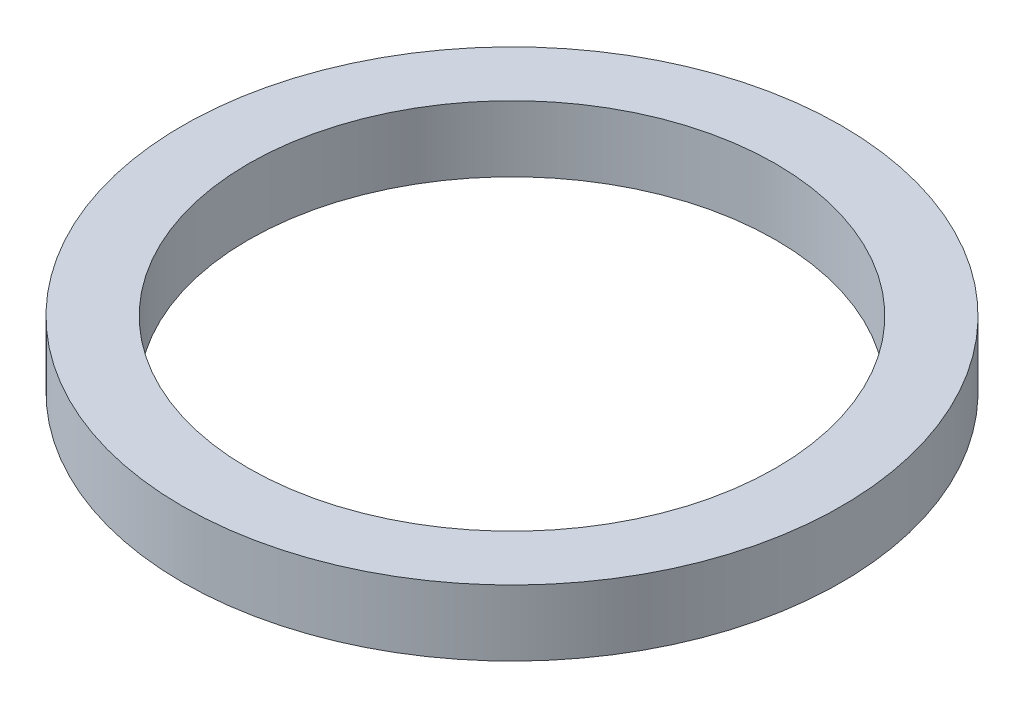
from build123d import *

# Parameters (mm, degrees)
CROQUIS1_R              = 5
CROQUIS1_R_2            = 4
SALIENTE_EXTRUIR1_DEPTH = 1


with BuildPart() as part:
    # Croquis1 → Saliente-Extruir1 (new body)
    with BuildSketch(Plane(origin=(0, 0, 0), x_dir=(1, 0, 0), z_dir=(0, 1, 0))):
        with Locations(Location((0, 0, 0), (0, 0, 270))):
            Circle(CROQUIS1_R)
        with Locations(Location((0, 0, 0), (0, 0, 270))):
            Circle(CROQUIS1_R_2, mode=Mode.SUBTRACT)
    extrude(amount=SALIENTE_EXTRUIR1_DEPTH)


solid = part.part
